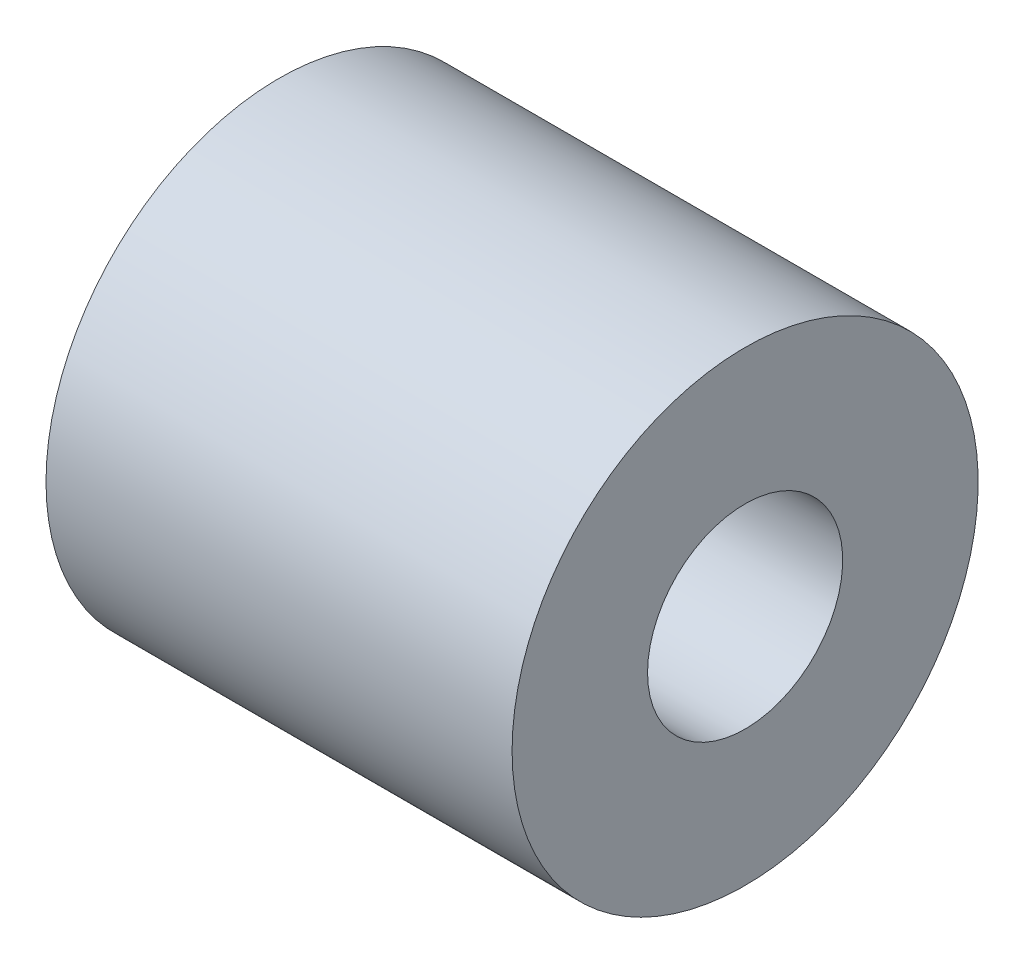
from build123d import *

# Parameters (mm, degrees)
SKETCH1_R           = 4.7625
SKETCH1_R_2         = 1.9939
BOSS_EXTRUDE1_DEPTH = 4.7625


with BuildPart() as part:
    # Sketch1 → Boss-Extrude1 (new, symmetric)
    with BuildSketch(Plane(origin=(0, 0, 0), x_dir=(0, 0, -1), z_dir=(1, 0, 0))):
        with Locations(Location((0, 0, 0), (0, 0, 180))):
            Circle(SKETCH1_R)
        with Locations(Location((0, 0, 0), (0, 0, 180))):
            Circle(SKETCH1_R_2, mode=Mode.SUBTRACT)
    extrude(amount=BOSS_EXTRUDE1_DEPTH, both=True)


solid = part.part
